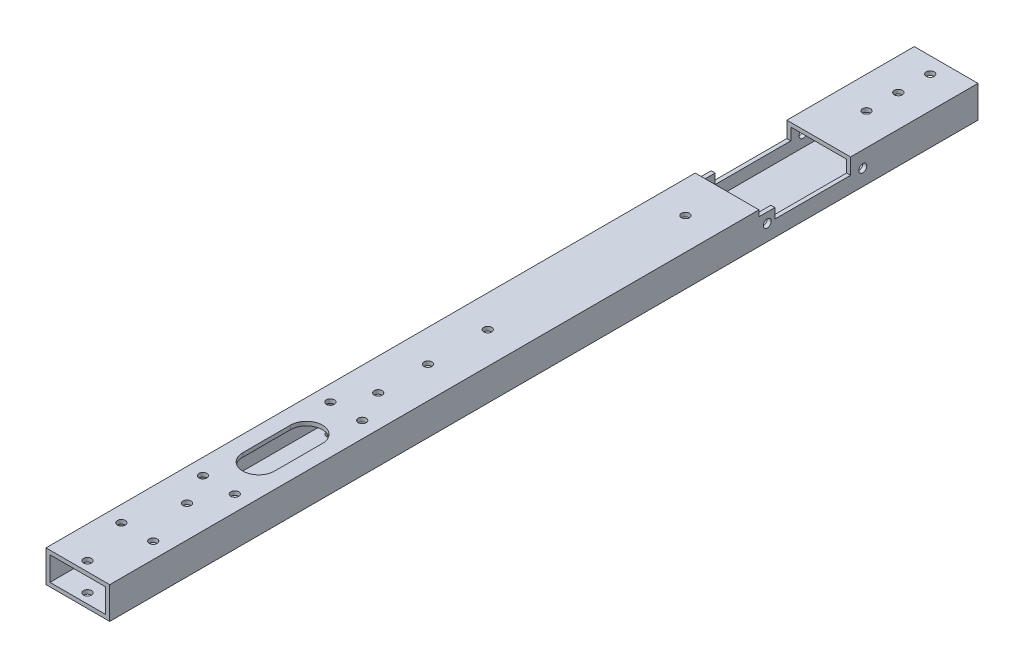
from build123d import *

# Parameters (mm, degrees)
SKETCH1_W           = 50.8
SKETCH1_H           = 25.4
SKETCH1_W_2         = 44.45
SKETCH1_H_2         = 19.05
BOSS_EXTRUDE1_DEPTH = 692.15
SKETCH2_W           = 60.325
SKETCH2_H           = 12.7
CUT_EXTRUDE1_DEPTH  = 695.127907882
SKETCH3_R           = 3.175
CUT_EXTRUDE2_DEPTH  = 695.127907882
SKETCH4_W           = 12.7
SKETCH4_H           = 4.7625
CUT_EXTRUDE3_DEPTH  = 695.127907882
SKETCH5_R           = 3.175
SKETCH5_R_2         = 2.0828
CUT_EXTRUDE4_DEPTH  = 694.081483305
CUT_EXTRUDE5_DEPTH  = 3.175
SKETCH8_R           = 3.175
CUT_EXTRUDE6_DEPTH  = 694.081483305


with BuildPart() as part:
    # Sketch1 → Boss-Extrude1 (new body)
    with BuildSketch(Plane.XY):
        Rectangle(SKETCH1_W, SKETCH1_H)
        Rectangle(SKETCH1_W_2, SKETCH1_H_2, mode=Mode.SUBTRACT)
    extrude(amount=BOSS_EXTRUDE1_DEPTH)

    # Sketch2 → Cut-Extrude1 (cut, through all)
    with BuildSketch(Plane(origin=(25.4, 0, 0), x_dir=(0, 0, -1), z_dir=(1, 0, 0))):
        with Locations((-131.7625, 6.35)):
            Rectangle(SKETCH2_W, SKETCH2_H)
    extrude(amount=-CUT_EXTRUDE1_DEPTH, mode=Mode.SUBTRACT)

    # Sketch3 → Cut-Extrude2 (cut, through all)
    with BuildSketch(Plane(origin=(25.4, 0, 0), x_dir=(0, 0, -1), z_dir=(1, 0, 0))):
        with Locations((-167.999918, 0)):
            Circle(SKETCH3_R)
        with Locations((-91.813888, 0)):
            Circle(SKETCH3_R)
    extrude(amount=-CUT_EXTRUDE2_DEPTH, mode=Mode.SUBTRACT)

    # Sketch4 → Cut-Extrude3 (cut, through all)
    with BuildSketch(Plane(origin=(25.4, 0, 0), x_dir=(0, 0, -1), z_dir=(1, 0, 0))):
        with Locations((-168.275, 10.31875)):
            Rectangle(SKETCH4_W, SKETCH4_H)
    extrude(amount=-CUT_EXTRUDE3_DEPTH, mode=Mode.SUBTRACT)

    # Sketch5 → Cut-Extrude4 (cut, through all)
    with BuildSketch(Plane(origin=(0, 12.7, 0), x_dir=(1, 0, 0), z_dir=(0, 1, 0))):
        with Locations(Location((0, -207.85963, 0), (0, 0, 180))):
            Circle(SKETCH5_R)
        with Locations(Location((0, -365.440722, 0), (0, 0, 180))):
            Circle(SKETCH5_R)
        with Locations(Location((0, -413.111442, 0), (0, 0, 180))):
            Circle(SKETCH5_R)
        with Locations(Location((0, -452.759064, 0), (0, 0, 180))):
            Circle(SKETCH5_R)
        with Locations(Location((-12.7, -478.159064, 0), (0, 0, 180))):
            Circle(SKETCH5_R)
        with Locations(Location((12.7, -478.159064, 0), (0, 0, 180))):
            Circle(SKETCH5_R)
        with Locations(Location((-12.7, -579.759064, 0), (0, 0, 180))):
            Circle(SKETCH5_R)
        with Locations(Location((12.7, -579.759064, 0), (0, 0, 180))):
            Circle(SKETCH5_R)
        with Locations(Location((0, -605.159064, 0), (0, 0, 180))):
            Circle(SKETCH5_R)
        with Locations(Location((-12.7, -644.806686, 0), (0, 0, 180))):
            Circle(SKETCH5_R)
        with Locations(Location((12.7, -644.806686, 0), (0, 0, 180))):
            Circle(SKETCH5_R)
        with Locations(Location((0, -684.454308, 0), (0, 0, 180))):
            Circle(SKETCH5_R)
        with Locations(Location((0, -548.009064, 0), (0, 0, 180))):
            Circle(SKETCH5_R_2)
        with Locations(Location((0, -535.309064, 0), (0, 0, 180))):
            Circle(SKETCH5_R_2)
        with Locations(Location((0, -522.609064, 0), (0, 0, 180))):
            Circle(SKETCH5_R_2)
        with Locations(Location((0, -509.909064, 0), (0, 0, 180))):
            Circle(SKETCH5_R_2)
    extrude(amount=-CUT_EXTRUDE4_DEPTH, mode=Mode.SUBTRACT)

    # Sketch7 → Cut-Extrude5 (cut)
    with BuildSketch(Plane(origin=(0, 12.7, 0), x_dir=(1, 0, 0), z_dir=(0, 1, 0))):
        with BuildLine():
            Line((-12.7, -548.009064), (-12.7, -509.909064))
            ThreePointArc((-12.7, -509.909064), (0, -497.209064), (12.7, -509.909064))
            Line((12.7, -509.909064), (12.7, -548.009064))
            ThreePointArc((12.7, -548.009064), (0, -560.709064), (-12.7, -548.009064))
        make_face()
    extrude(amount=-CUT_EXTRUDE5_DEPTH, mode=Mode.SUBTRACT)

    # Sketch8 → Cut-Extrude6 (cut, through all)
    with BuildSketch(Plane(origin=(0, 12.7, 0), x_dir=(1, 0, 0), z_dir=(0, 1, 0))):
        with Locations(Location((0, -12.7, 0), (0, 0, 180))):
            Circle(SKETCH8_R)
        with Locations(Location((0, -38.1, 0), (0, 0, 180))):
            Circle(SKETCH8_R)
        with Locations(Location((0, -63.5, 0), (0, 0, 180))):
            Circle(SKETCH8_R)
    extrude(amount=-CUT_EXTRUDE6_DEPTH, mode=Mode.SUBTRACT)


solid = part.part
